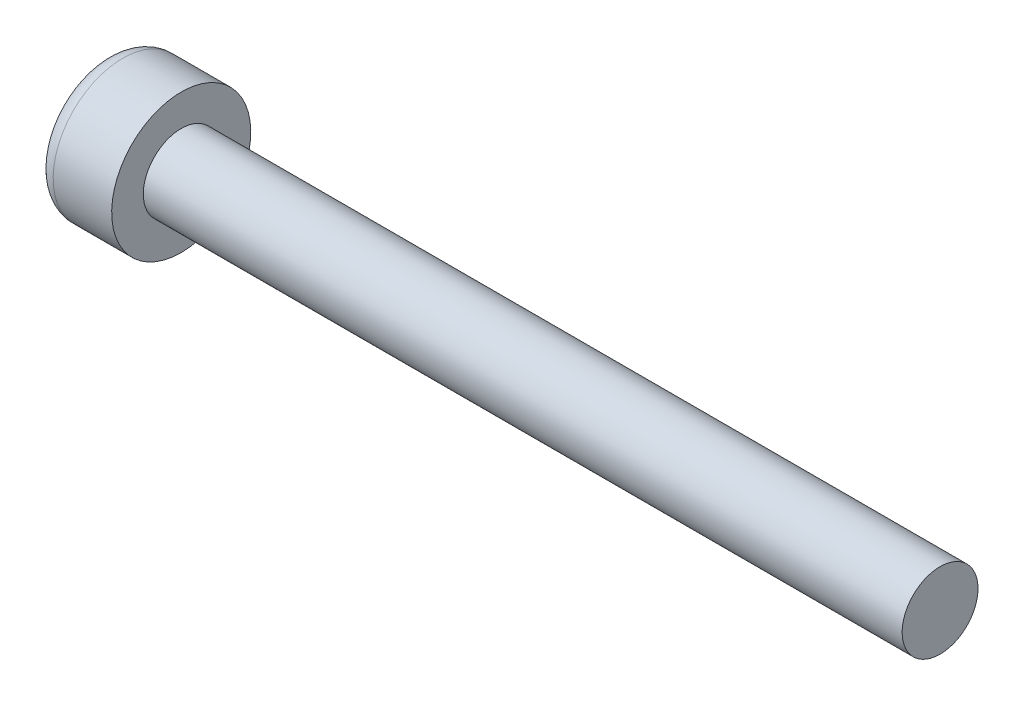
from build123d import *

# Parameters (mm, degrees)
CUT_EXTRUDE1_DEPTH = 1.5


with BuildPart() as part:
    # Sketch1 → Revolve1 (revolve)
    with BuildSketch(Plane.XY, mode=Mode.PRIVATE) as revolve1_sk:
        with BuildLine():
            Line((0, 0), (0, 2.0625))
            ThreePointArc((0, 2.0625), (0.201364088, 2.548635912), (0.6875, 2.75))
            Line((0.6875, 2.75), (3, 2.75))
            Line((3, 2.75), (3, 1.5))
            Line((3, 1.5), (33, 1.5))
            Line((33, 1.5), (33, 0))
            Line((33, 0), (0, 0))
        make_face()
    revolve(revolve1_sk.sketch.rotate(Axis((0, 0, 0), (1, 0, 0)), 180), axis=Axis((0, 0, 0), (1, 0, 0)))

    # Sketch2 → Cut-Extrude1 (cut)
    with BuildSketch(Plane.ZY):
        Polygon((0, 1.443375673), (-1.25, 0.721687836), (-1.25, -0.721687836), (0, -1.443375673), (1.25, -0.721687836), (1.25, 0.721687836), align=None)
    extrude(amount=-CUT_EXTRUDE1_DEPTH, mode=Mode.SUBTRACT)


solid = part.part
